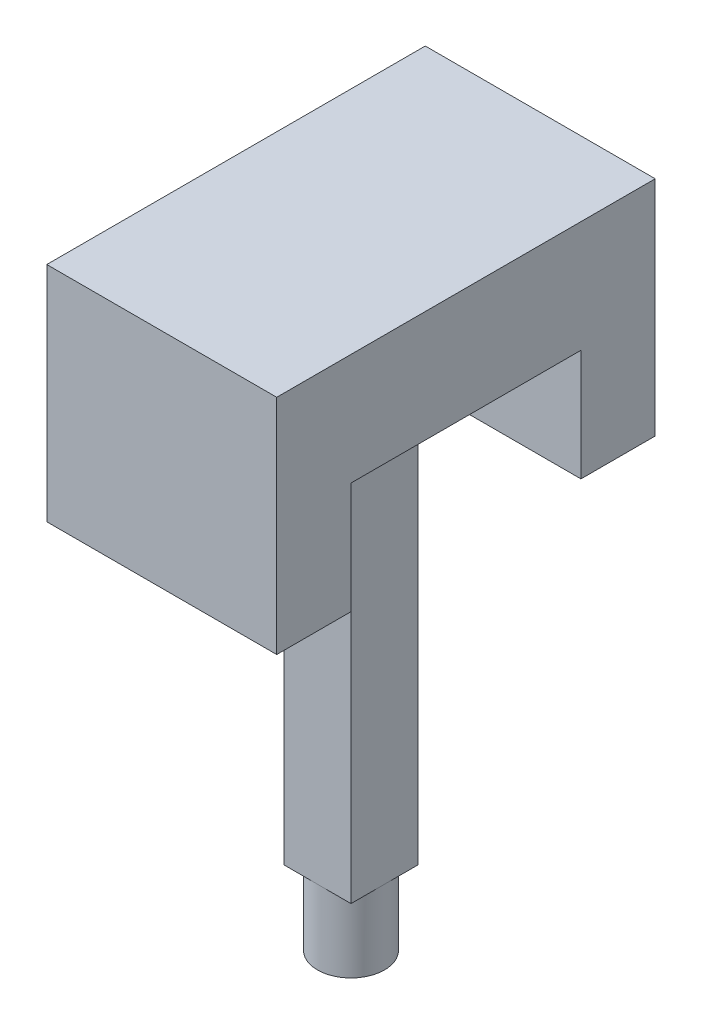
from build123d import *

# Parameters (mm, degrees)
SKETCH1_W           = 1.506666666
SKETCH1_H           = 1.506666666
PIN_DEPTH           = 10
SKETCH2_R           = 0.753333333
TIP_DEPTH           = 1.666666667
SKETCH3_W           = 5.16
SKETCH3_H           = 8.493333334
HANDLE_DEPTH        = 2.5
SKETCH3_3_W         = 5.16
SKETCH3_3_H         = 1.666666667
BOSS_EXTRUDE4_DEPTH = 2.5


with BuildPart() as part:
    # Sketch1 → Pin (new body)
    with BuildSketch(Plane(origin=(0, 0, 0), x_dir=(1, 0, 0), z_dir=(0, 1, 0))):
        Rectangle(SKETCH1_W, SKETCH1_H)
    extrude(amount=PIN_DEPTH)

    # Sketch2 → Tip (add)
    with BuildSketch(Plane.XZ):
        Circle(SKETCH2_R)
    extrude(amount=TIP_DEPTH)

    # Sketch3 → Handle (add)
    with BuildSketch(Plane(origin=(0, 10, 0), x_dir=(1, 0, 0), z_dir=(0, 1, 0))):
        Rectangle(SKETCH3_W, SKETCH3_H)
    extrude(amount=HANDLE_DEPTH)

    # Sketch3<3> → Boss-Extrude4 (add)
    with BuildSketch(Plane(origin=(0, 10, 0), x_dir=(1, 0, 0), z_dir=(0, 1, 0))):
        with Locations((0, 3.413333334)):
            Rectangle(SKETCH3_3_W, SKETCH3_3_H)
        with Locations((0, -3.413333334)):
            Rectangle(SKETCH3_3_W, SKETCH3_3_H)
    extrude(amount=-BOSS_EXTRUDE4_DEPTH)


solid = part.part
